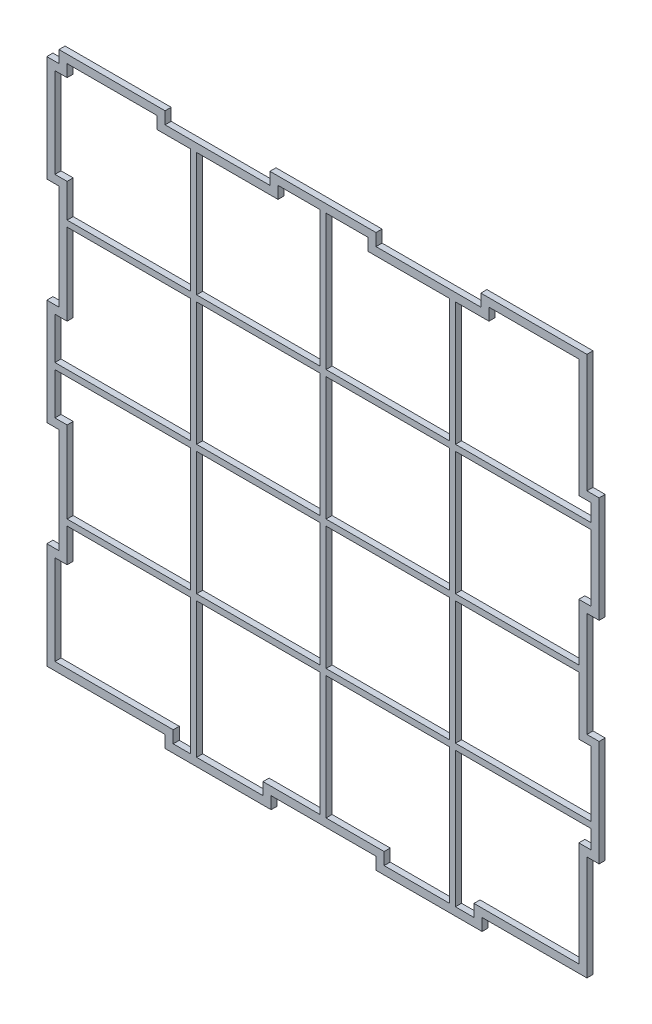
from build123d import *

# Parameters (mm, degrees)
BOSS_EXTRUDE1_DEPTH     = 1.5
CUT_EXTRUDE1_DEPTH      = 97.178219988
CUT_EXTRUDE1_DEPTH_BACK = 97.178219988
SKETCH3_W               = 30.375
SKETCH3_H               = 30.375
BOSS_EXTRUDE2_DEPTH     = 1.5


with BuildPart() as part:
    # Sketch1 → Boss-Extrude1 (new body)
    with BuildSketch(Plane.XY):
        Polygon((65, 38.88), (68, 38.88), (68, 12.76), (65, 12.76), (65, -13.06), (68, -13.06), (68, -39.18), (65, -39.18), (65, -65), (39.18, -65), (39.18, -68), (13.06, -68), (13.06, -65), (-12.76, -65), (-12.76, -68), (-38.88, -68), (-38.88, -65), (-64.7, -65), (-68, -65), (-68, -38.88), (-65, -38.88), (-65, -13.06), (-68, -13.06), (-68, 13.06), (-65, 13.06), (-65, 38.88), (-68, 38.88), (-68, 65), (-65, 65), (-65, 68), (-38.88, 68), (-38.88, 65), (-13.06, 65), (-13.06, 68), (13.06, 68), (13.06, 65), (38.88, 65), (38.88, 68), (65, 68), (65, 64.7), align=None)
    extrude(amount=BOSS_EXTRUDE1_DEPTH)

    # Sketch2 → Cut-Extrude1 (cut, two sides: drawn at the far end of the back side and taken through both)
    with BuildSketch(Plane.XY.offset(1.5).offset(-CUT_EXTRUDE1_DEPTH_BACK)):
        Polygon((63, -63), (37.18, -63), (37.18, -66), (15.06, -66), (15.06, -63), (-14.76, -63), (-14.76, -66), (-36.88, -66), (-36.88, -63), (-63, -63), (-66, -63), (-66, -40.88), (-63, -40.88), (-63, -11.06), (-66, -11.06), (-66, 11.06), (-63, 11.06), (-63, 40.88), (-66, 40.88), (-66, 63), (-63, 63), (-63, 66), (-40.88, 66), (-40.88, 63), (-11.06, 63), (-11.06, 66), (11.06, 66), (11.06, 63), (40.88, 63), (40.88, 66), (63, 66), (63, 63), (63, 36.88), (66, 36.88), (66, 14.76), (63, 14.76), (63, -15.06), (66, -15.06), (66, -37.18), (63, -37.18), align=None)
    extrude(amount=CUT_EXTRUDE1_DEPTH + CUT_EXTRUDE1_DEPTH_BACK, mode=Mode.SUBTRACT)

    # Sketch3 → Boss-Extrude2 (add, through all)
    with BuildSketch(Plane.XY.offset(1.5)):
        Polygon((0.75, -32.625), (31.125, -32.625), (31.125, -66), (32.625, -66), (32.625, -32.625), (66, -32.625), (66, -31.125), (32.625, -31.125), (32.625, -0.75), (63, -0.75), (63, 0.75), (32.625, 0.75), (32.625, 31.125), (66, 31.125), (66, 32.625), (32.625, 32.625), (32.625, 63), (31.125, 63), (31.125, 32.625), (0.75, 32.625), (0.75, 66), (-0.75, 66), (-0.75, 32.625), (-31.125, 32.625), (-31.125, 63), (-32.625, 63), (-32.625, 32.625), (-63, 32.625), (-63, 31.125), (-32.625, 31.125), (-32.625, 0.75), (-66, 0.75), (-66, -0.75), (-32.625, -0.75), (-32.625, -31.125), (-63, -31.125), (-63, -32.625), (-32.625, -32.625), (-32.625, -66), (-31.125, -66), (-31.125, -32.625), (-0.75, -32.625), (-0.75, -63), (0.75, -63), align=None)
        with Locations((-15.9375, -15.9375)):
            Rectangle(SKETCH3_W, SKETCH3_H, mode=Mode.SUBTRACT)
        with Locations((15.9375, -15.9375)):
            Rectangle(SKETCH3_W, SKETCH3_H, mode=Mode.SUBTRACT)
        with Locations((-15.9375, 15.9375)):
            Rectangle(SKETCH3_W, SKETCH3_H, mode=Mode.SUBTRACT)
        with Locations((15.9375, 15.9375)):
            Rectangle(SKETCH3_W, SKETCH3_H, mode=Mode.SUBTRACT)
    extrude(amount=-BOSS_EXTRUDE2_DEPTH)


solid = part.part
